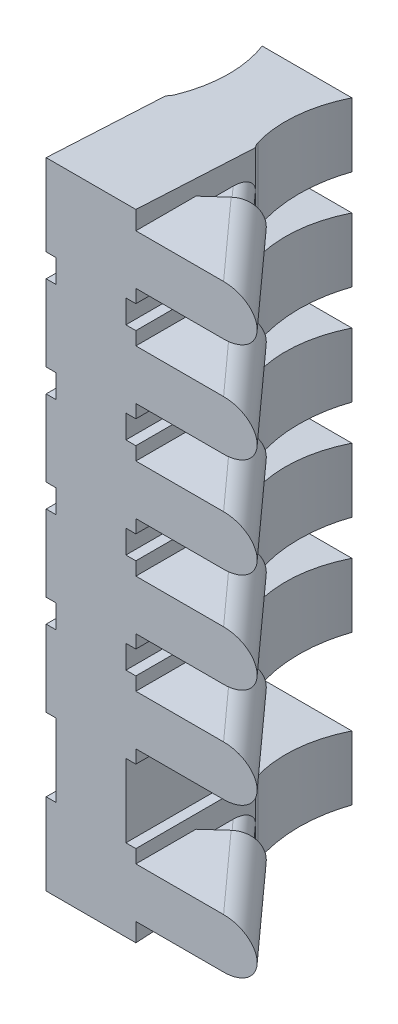
from build123d import *

# Parameters (mm, degrees)
SKETCH1_W           = 15
SKETCH1_H           = 30
BOSS_EXTRUDE1_DEPTH = 7
CUT_EXTRUDE1_START  = -0.3
CUT_EXTRUDE1_DEPTH  = 2.1
CUT_EXTRUDE4_DEPTH  = 2.7
BOSS_EXTRUDE2_DEPTH = 24.556743
CUT_EXTRUDE2_DEPTH  = 27.627139608
CUT_EXTRUDE3_DEPTH  = 27.401285317
SKETCH13_W          = 10
SKETCH13_H          = 20
BOSS_EXTRUDE3_DEPTH = 7
SKETCH14_W          = 3.65
SKETCH14_H          = 19.113486034
CUT_EXTRUDE5_DEPTH  = 13.592908206


with BuildPart() as part:
    # Sketch1 → Boss-Extrude1 (new body)
    with BuildSketch(Plane.XY):
        Rectangle(SKETCH1_W, SKETCH1_H)
    extrude(amount=-BOSS_EXTRUDE1_DEPTH)

    # Sketch8 → Cut-Extrude1 (cut)
    with BuildSketch(Plane(origin=(1.35, 0, 0), x_dir=(0, 0, -1), z_dir=(1, 0, 0)).offset(CUT_EXTRUDE1_START)):
        Polygon((6.5, -4.716092451), (6.5, -2.783907549), (3, -2.600480321), (3, -1.899519679), (6.5, -1.716092451), (6.5, 0.216092451), (3, 0.399519679), (3, 1.100480321), (6.5, 1.283907549), (6.5, 3.216092451), (3, 3.399519679), (3, 4.100480321), (6.5, 4.283907549), (6.5, 6.216092451), (3, 6.399519679), (3, 7.100480321), (6.5, 7.283907549), (6.5, 9.216092451), (0, 9.556743017), (0, -9.556743017), (6.5, -9.216092451), (6.5, -7.283907549), (3, -7.100480321), (3, -4.899519679), align=None)
    extrude(amount=-CUT_EXTRUDE1_DEPTH, mode=Mode.SUBTRACT)

    # Sketch7 → Cut-Extrude4 (cut)
    with BuildSketch(Plane(origin=(1.35, 0, 0), x_dir=(0, 0, -1), z_dir=(1, 0, 0))):
        Polygon((3, 4.100480321), (0, 4.100480321), (0, 6.399519679), (3, 6.399519679), (6.5, 6.216092451), (6.5, 4.283907549), align=None)
        Polygon((3, 1.100480321), (0, 1.100480321), (0, 3.399519679), (3, 3.399519679), (6.5, 3.216092451), (6.5, 1.283907549), align=None)
        Polygon((3, -1.899519679), (0, -1.899519679), (0, 0.399519679), (3, 0.399519679), (6.5, 0.216092451), (6.5, -1.716092451), align=None)
        Polygon((3, -4.899519679), (0, -4.899519679), (0, -2.600480321), (3, -2.600480321), (6.5, -2.783907549), (6.5, -4.716092451), align=None)
        Polygon((3, -7.100480321), (0, -7.100480321), (0, -9.556743017), (6.5, -9.216092451), (6.5, -7.283907549), align=None)
        Polygon((3, 7.100480321), (0, 7.100480321), (0, 9.556743017), (6.5, 9.216092451), (6.5, 7.283907549), align=None)
    extrude(amount=-CUT_EXTRUDE4_DEPTH, mode=Mode.SUBTRACT)

    # Sketch10 → Boss-Extrude2 (add)
    with BuildSketch(Plane(origin=(0, -9.556743017, 0), x_dir=(1, 0, 0), z_dir=(0, 1, 0))):
        with BuildLine():
            Line((1.35, 3.599507213), (1.35, 6.5))
            ThreePointArc((1.35, 6.5), (1.052815056, 5.148153684), (1.246508191, 3.777646361))
            ThreePointArc((1.246508191, 3.777646361), (1.288979573, 3.683188656), (1.35, 3.599507213))
        make_face()
        with BuildLine():
            Line((-1.35, 3.599507213), (-1.35, 6.5))
            ThreePointArc((-1.35, 6.5), (-1.052815056, 5.148153684), (-1.246508191, 3.777646361))
            ThreePointArc((-1.246508191, 3.777646361), (-1.288979573, 3.683188656), (-1.35, 3.599507213))
        make_face()
    extrude(amount=BOSS_EXTRUDE2_DEPTH)

    # Sketch12 → Cut-Extrude2 (cut, through all)
    with BuildSketch(Plane(origin=(3.10411931, 9.156194078, -3.38952842), x_dir=(0, -1, 0), z_dir=(0.669702306213578, 0, 0.7426296661541438))):
        with BuildLine():
            Line((0.156194078, -1.612037756), (0.156194078, -5.06124645))
            Line((0.156194078, -5.06124645), (1.656194078, -5.06124645))
            Line((1.656194078, -5.06124645), (1.656194078, -1.612037756))
            ThreePointArc((1.656194078, -1.612037756), (0.906194078, -0.862037756), (0.156194078, -1.612037756))
        make_face()
        with BuildLine():
            Line((3.156194078, -1.612037756), (3.156194078, -5.06124645))
            Line((3.156194078, -5.06124645), (4.656194078, -5.06124645))
            Line((4.656194078, -5.06124645), (4.656194078, -1.612037756))
            ThreePointArc((4.656194078, -1.612037756), (3.906194078, -0.862037756), (3.156194078, -1.612037756))
        make_face()
        with BuildLine():
            Line((6.156194078, -1.612037756), (6.156194078, -5.06124645))
            Line((6.156194078, -5.06124645), (7.656194078, -5.06124645))
            Line((7.656194078, -5.06124645), (7.656194078, -1.612037756))
            ThreePointArc((7.656194078, -1.612037756), (6.906194078, -0.862037756), (6.156194078, -1.612037756))
        make_face()
        with BuildLine():
            Line((9.156194078, -1.612037756), (9.156194078, -5.06124645))
            Line((9.156194078, -5.06124645), (10.656194078, -5.06124645))
            Line((10.656194078, -5.06124645), (10.656194078, -1.612037756))
            ThreePointArc((10.656194078, -1.612037756), (9.906194078, -0.862037756), (9.156194078, -1.612037756))
        make_face()
        with BuildLine():
            Line((12.156194078, -1.612037756), (12.156194078, -5.06124645))
            Line((12.156194078, -5.06124645), (13.656194078, -5.06124645))
            Line((13.656194078, -5.06124645), (13.656194078, -1.612037756))
            ThreePointArc((13.656194078, -1.612037756), (12.906194078, -0.862037756), (12.156194078, -1.612037756))
        make_face()
        with BuildLine():
            Line((16.656194078, -1.612037756), (16.656194078, -5.06124645))
            Line((16.656194078, -5.06124645), (18.156194078, -5.06124645))
            Line((18.156194078, -5.06124645), (18.156194078, -1.612037756))
            ThreePointArc((18.156194078, -1.612037756), (17.406194078, -0.862037756), (16.656194078, -1.612037756))
        make_face()
    cut_extrude2 = extrude(amount=CUT_EXTRUDE2_DEPTH, mode=Mode.SUBTRACT)

    # Sketch11 → Cut-Extrude3 (cut, through all)
    with BuildSketch(Plane(origin=(2.212963711, 9.156194078, -4.377726578), x_dir=(0, -1, 0), z_dir=(0.6697023062135781, 0, 0.7426296661541438))):
        with BuildLine():
            Line((0.456194078, -2.362037756), (0.456194078, -1.612037756))
            ThreePointArc((0.456194078, -1.612037756), (0.906194078, -1.162037756), (1.356194078, -1.612037756))
            Line((1.356194078, -1.612037756), (1.356194078, -2.362037756))
            Line((1.356194078, -2.362037756), (0.456194078, -2.362037756))
        make_face()
        with BuildLine():
            Line((3.456194078, -1.612037756), (3.456194078, -2.362037756))
            Line((3.456194078, -2.362037756), (4.356194078, -2.362037756))
            Line((4.356194078, -2.362037756), (4.356194078, -1.612037756))
            ThreePointArc((4.356194078, -1.612037756), (3.906194078, -1.162037756), (3.456194078, -1.612037756))
        make_face()
        with BuildLine():
            Line((7.356194078, -1.612037756), (7.356194078, -2.362037756))
            Line((7.356194078, -2.362037756), (6.456194078, -2.362037756))
            Line((6.456194078, -2.362037756), (6.456194078, -1.612037756))
            ThreePointArc((6.456194078, -1.612037756), (6.906194078, -1.162037756), (7.356194078, -1.612037756))
        make_face()
        with BuildLine():
            Line((9.456194078, -1.612037756), (9.456194078, -2.362037756))
            Line((9.456194078, -2.362037756), (10.356194078, -2.362037756))
            Line((10.356194078, -2.362037756), (10.356194078, -1.612037756))
            ThreePointArc((10.356194078, -1.612037756), (9.906194078, -1.162037756), (9.456194078, -1.612037756))
        make_face()
        with BuildLine():
            Line((13.356194078, -1.612037756), (13.356194078, -2.362037756))
            Line((13.356194078, -2.362037756), (12.456194078, -2.362037756))
            Line((12.456194078, -2.362037756), (12.456194078, -1.612037756))
            ThreePointArc((12.456194078, -1.612037756), (12.906194078, -1.162037756), (13.356194078, -1.612037756))
        make_face()
        with BuildLine():
            Line((16.956194078, -1.612037756), (16.956194078, -2.362037756))
            Line((16.956194078, -2.362037756), (17.856194078, -2.362037756))
            Line((17.856194078, -2.362037756), (17.856194078, -1.612037756))
            ThreePointArc((17.856194078, -1.612037756), (17.406194078, -1.162037756), (16.956194078, -1.612037756))
        make_face()
    cut_extrude3 = extrude(amount=CUT_EXTRUDE3_DEPTH, mode=Mode.SUBTRACT)

    # Mirror1: Cut-Extrude2, Cut-Extrude3 across plane
    add(cut_extrude2.mirror(Plane(origin=(0, 0, 0), x_dir=(0, 0, 1), z_dir=(1, 0, 0))), mode=Mode.SUBTRACT)
    add(cut_extrude3.mirror(Plane(origin=(0, 0, 0), x_dir=(0, 0, 1), z_dir=(1, 0, 0))), mode=Mode.SUBTRACT)


with BuildPart() as body_2:
    # Sketch13 → Boss-Extrude3 (new body)
    with BuildSketch(Plane.XY):
        Rectangle(SKETCH13_W, SKETCH13_H)
    extrude(amount=-BOSS_EXTRUDE3_DEPTH)

    # Combine1: cut part
    add(part.part, mode=Mode.SUBTRACT)

    # Sketch14 → Cut-Extrude5 (cut, through all)
    with BuildSketch(Plane.XY):
        with Locations((-3.175, 0)):
            Rectangle(SKETCH14_W, SKETCH14_H)
    extrude(amount=-CUT_EXTRUDE5_DEPTH, mode=Mode.SUBTRACT)


solid = body_2.part
